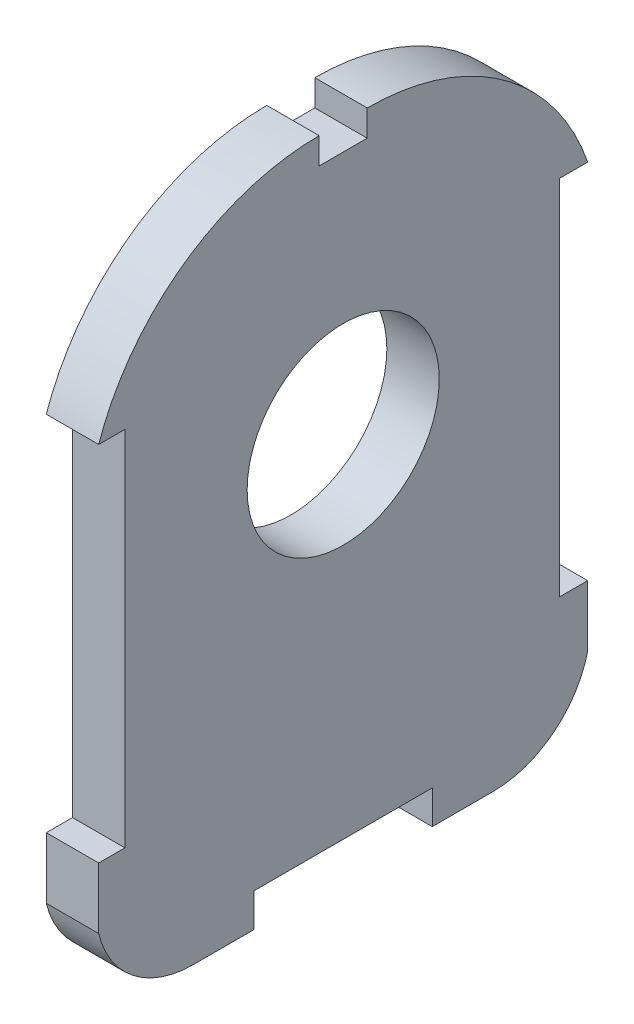
from build123d import *

# Parameters (mm, degrees)
SKETCH1_R           = 11
BOSS_EXTRUDE1_DEPTH = 6
CUT_EXTRUDE3_DEPTH  = 41.5
CUT_EXTRUDE5_DEPTH  = 20.4


with BuildPart() as part:
    # Sketch1 → Boss-Extrude1 (new body)
    with BuildSketch(Plane(origin=(0, 0, 0), x_dir=(0, 0, -1), z_dir=(1, 0, 0))):
        with BuildLine():
            Line((-10.2, -3), (-10.2, 0))
            Line((-10.2, 0), (10.2, 0))
            Line((10.2, 0), (10.2, -3))
            Line((10.2, -3), (17.2, -3))
            ThreePointArc((17.2, -3), (24.071862921, -0.620131711), (28, 5.5))
            Line((28, 5.5), (28, 12.5))
            Line((28, 12.5), (25, 12.5))
            Line((25, 12.5), (25, 41))
            Line((25, 41), (25, 54))
            Line((25, 54), (28, 54))
            ThreePointArc((28, 54), (18.254535627, 67.039348587), (2.75, 72))
            Line((2.75, 72), (2.75, 69))
            Line((2.75, 69), (-2.75, 69))
            Line((-2.75, 69), (-2.75, 72))
            ThreePointArc((-2.75, 72), (-18.254535627, 67.039348587), (-28, 54))
            Line((-28, 54), (-25, 54))
            Line((-25, 54), (-25, 41))
            Line((-25, 41), (-25, 12.5))
            Line((-25, 12.5), (-28, 12.5))
            Line((-28, 12.5), (-28, 5.5))
            ThreePointArc((-28, 5.5), (-24.071862921, -0.620131711), (-17.2, -3))
            Line((-17.2, -3), (-10.2, -3))
        make_face()
        with Locations((0, 41)):
            Circle(SKETCH1_R, mode=Mode.SUBTRACT)
    extrude(amount=BOSS_EXTRUDE1_DEPTH)

    # Sketch5 → Cut-Extrude3 (cut)
    with BuildSketch(Plane.XZ.offset(-54)):
        Polygon((0, -25), (6, -25), (6, -24.751672534), align=None)
    extrude(amount=CUT_EXTRUDE3_DEPTH, mode=Mode.SUBTRACT)

    # Sketch6 → Cut-Extrude5 (cut)
    with BuildSketch(Plane.XY.offset(-10.2)):
        Polygon((0, 0), (6, 0), (6, 0.843245008), align=None)
    extrude(amount=CUT_EXTRUDE5_DEPTH, mode=Mode.SUBTRACT)


solid = part.part
